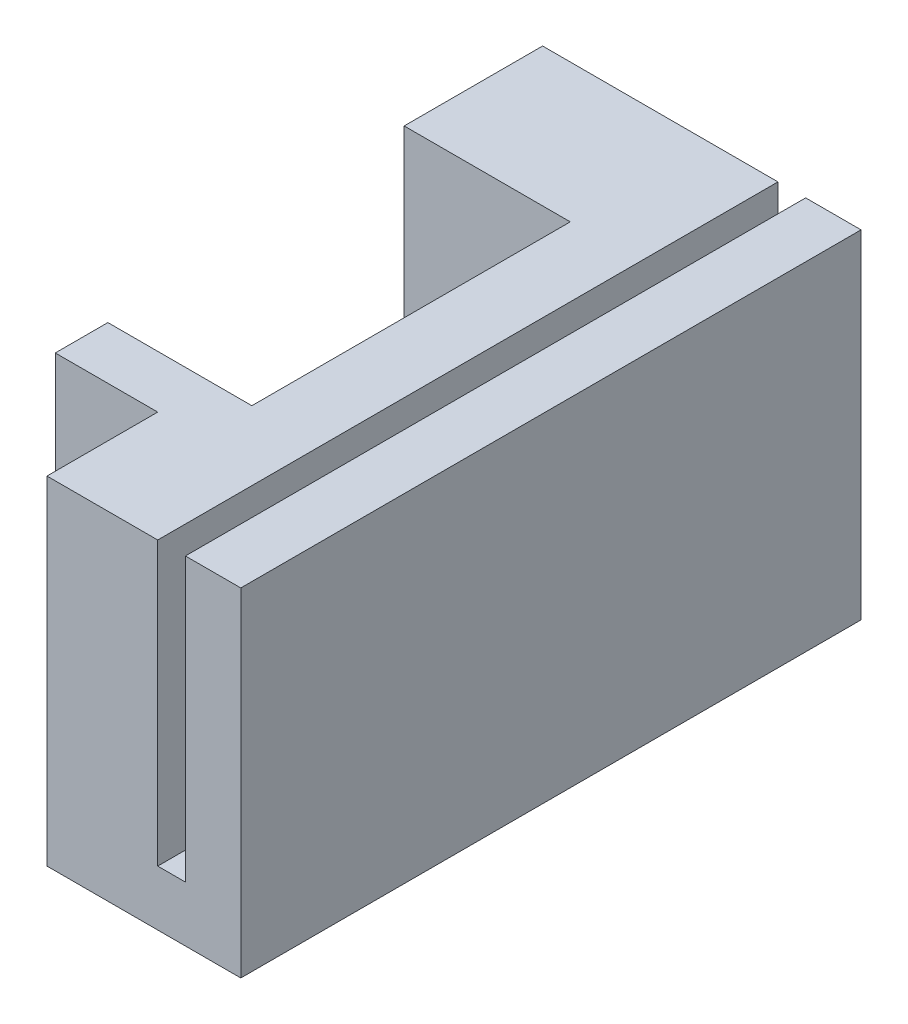
from build123d import *

# Parameters (mm, degrees)
BOSS_EXTRUDE1_DEPTH   = 12.2
SKETCH1_W             = 2
SKETCH1_H             = 22.4
BOSS_EXTRUDE1_2_DEPTH = 12.2
SKETCH1_4_W           = 1
SKETCH1_4_H           = 22.4
BOSS_EXTRUDE2_DEPTH   = 2


with BuildPart() as part:
    # Sketch1 → Boss-Extrude1 (new body)
    with BuildSketch(Plane(origin=(0, 0, 0), x_dir=(1, 0, 0), z_dir=(0, 1, 0))):
        Polygon((0, 5), (0, 0), (6, 0), (6, -11.5), (0.8, -11.5), (0.8, -13.4), (4.5, -13.4), (4.5, -17.4), (8.5, -17.4), (8.5, 5), align=None)
    extrude(amount=BOSS_EXTRUDE1_DEPTH)



with BuildPart() as body_2:
    # Sketch1 → Boss-Extrude1 2 (new body)
    with BuildSketch(Plane(origin=(0, 0, 0), x_dir=(1, 0, 0), z_dir=(0, 1, 0))):
        with Locations((10.5, -6.2)):
            Rectangle(SKETCH1_W, SKETCH1_H)
    extrude(amount=BOSS_EXTRUDE1_2_DEPTH)


with BuildPart() as part_1:
    add(part.part)

    add(body_2.part)  # Boss-Extrude2 merges body 2
    # Sketch1<4> → Boss-Extrude2 (add)
    with BuildSketch(Plane(origin=(0, 0, 0), x_dir=(1, 0, 0), z_dir=(0, 1, 0))):
        with Locations((9, -6.2)):
            Rectangle(SKETCH1_4_W, SKETCH1_4_H)
    extrude(amount=BOSS_EXTRUDE2_DEPTH)


solid = part_1.part
